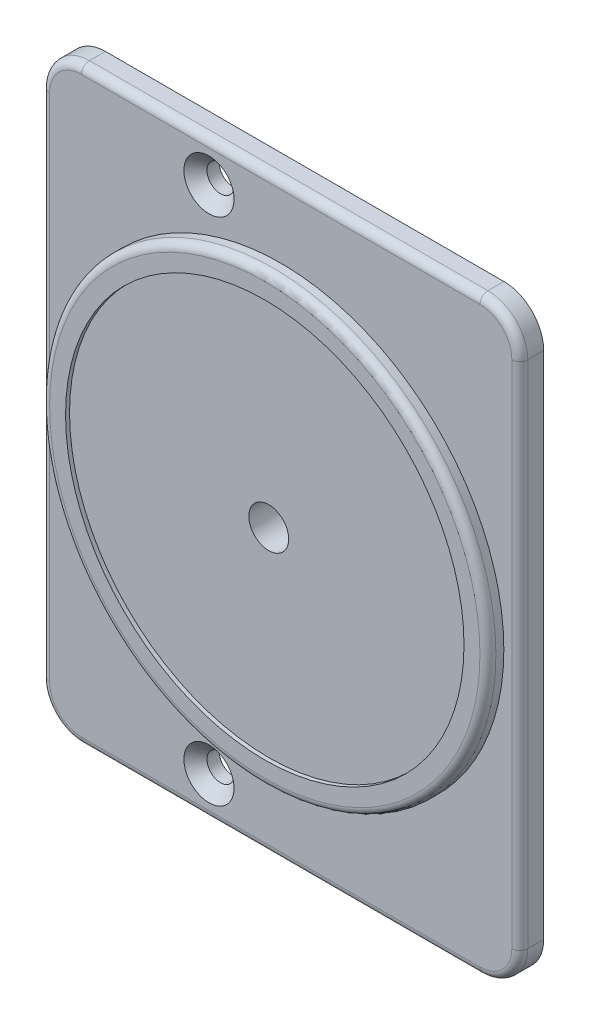
from build123d import *

# Parameters (mm, degrees)
ESQUISSE1_W                                 = 60
ESQUISSE1_H                                 = 74
BOSS_EXTRU_1_DEPTH                          = 3
ESQUISSE2_R                                 = 28
BOSS_EXTRU_2_DEPTH                          = 2
ESQUISSE6_R                                 = 25
ENL_V_MAT_EXTRU_4_DEPTH                     = 0.5
CONG_5_R                                    = 5
CONG_1_R                                    = 1
ESQUISSE7_R                                 = 2.5
ENL_V_MAT_EXTRU_5_DEPTH                     = 48.895720059
FRAISAGE_POUR_VIS_T_TE_FRAIS_E_M31_AT_COUNT = 2
FRAISAGE_POUR_VIS_T_TE_FRAIS_E_M31_AT_PITCH = 64


with BuildPart() as part:
    # Esquisse1 → Boss.-Extru.1 (new body)
    with BuildSketch(Plane.XY):
        Rectangle(ESQUISSE1_W, ESQUISSE1_H)
    extrude(amount=-BOSS_EXTRU_1_DEPTH)

    # Esquisse2 → Boss.-Extru.2 (add)
    with BuildSketch(Plane.XY):
        Circle(ESQUISSE2_R)
    extrude(amount=BOSS_EXTRU_2_DEPTH)

    # Esquisse6 → Enlèv. mat.-Extru.4 (cut)
    with BuildSketch(Plane.XY.offset(2)):
        Circle(ESQUISSE6_R)
    extrude(amount=-ENL_V_MAT_EXTRU_4_DEPTH, mode=Mode.SUBTRACT)

    # Congé 5
    cong_5_edges = [part.edges().sort_by_distance(p)[0] for p in [
        (-30, 37, -1.5),
        (30, 37, -1.5),
        (30, -37, -1.5),
        (-30, -37, -1.5),
    ]]
    fillet(cong_5_edges, radius=CONG_5_R)

    # Congé1
    cong_1_edges = [part.edges().sort_by_distance(p)[0] for p in [
        (-28, 0, 2),
        (0, -37, 0),
        (-30, 0, 0),
        (30, 0, 0),
        (0, 37, 0),
        (-28.535533906, 35.535533906, 0),
        (28.535533906, 35.535533906, 0),
        (-28.535533906, -35.535533906, 0),
        (28.535533906, -35.535533906, 0),
    ]]
    fillet(cong_1_edges, radius=CONG_1_R)

    # Esquisse7 → Enlèv. mat.-Extru.5 (cut, through all)
    with BuildSketch(Plane(origin=(0, 0, -3), x_dir=(-1, 0, 0), z_dir=(0, 0, -1))):
        Circle(ESQUISSE7_R)
    extrude(amount=-ENL_V_MAT_EXTRU_5_DEPTH, mode=Mode.SUBTRACT)

    # Esquisse8 → Fraisage pour vis à tête fraisée M31 (revolve, cut)
    with BuildSketch(Plane(origin=(-9, 32, 0), x_dir=(0, -1, 0), z_dir=(1, 0, 0))):
        Polygon((0, 0), (0, 3), (1.7, 3), (1.7, 1.45), (3.15, 0), align=None)
    fraisage_pour_vis_t_te_frais_e_m31 = revolve(axis=Axis((-9, 32, 6.35), (0, 0, -1)), mode=Mode.SUBTRACT)

    # Fraisage pour vis à tête fraisée M31 at: Fraisage pour vis à tête fraisée M31 ×2
    with Locations(*[(0, -i * FRAISAGE_POUR_VIS_T_TE_FRAIS_E_M31_AT_PITCH, 0) for i in range(1, FRAISAGE_POUR_VIS_T_TE_FRAIS_E_M31_AT_COUNT)]):
        add(fraisage_pour_vis_t_te_frais_e_m31, mode=Mode.SUBTRACT)


solid = part.part
